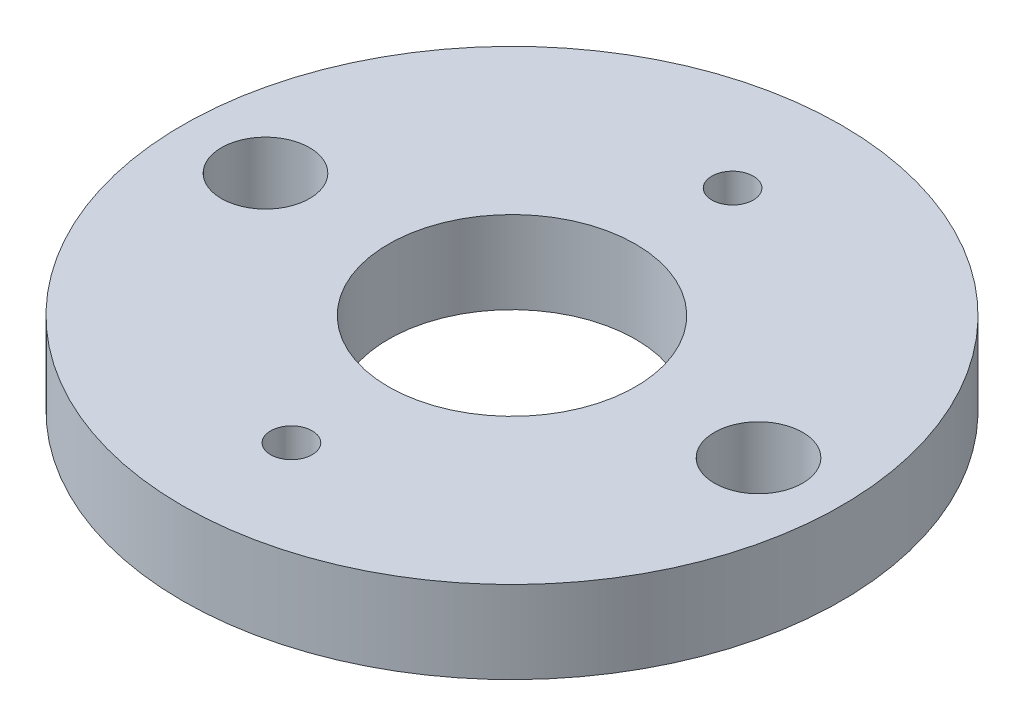
from build123d import *

# Parameters (mm, degrees)
SKETCH1_R                       = 12.7
SKETCH1_R_2                     = 4.7625
BOSS_EXTRUDE1_DEPTH             = 3.175
M3_CLEARANCE_HOLE1_D            = 3.4
M3_CLEARANCE_HOLE1_DEPTH        = 6.35
M3_CLEARANCE_HOLE1_TIP          = 1.021463052
TAP_DRILL_FOR_M2X0_4_TAP1_D     = 1.6
TAP_DRILL_FOR_M2X0_4_TAP1_DEPTH = 6.35
TAP_DRILL_FOR_M2X0_4_TAP1_TIP   = 0.480688495


with BuildPart() as part:
    # Sketch1 → Boss-Extrude1 (new body)
    with BuildSketch(Plane(origin=(0, 0, 0), x_dir=(1, 0, 0), z_dir=(0, 1, 0))):
        with Locations(Location((0, 0, 0), (0, 0, 270))):
            Circle(SKETCH1_R)
        with Locations(Location((0, 0, 0), (0, 0, 270))):
            Circle(SKETCH1_R_2, mode=Mode.SUBTRACT)
    extrude(amount=BOSS_EXTRUDE1_DEPTH)

    # M3 Clearance Hole1
    with Locations(Plane(origin=(0, 3.175, 0), x_dir=(1, 0, 0), z_dir=(0, 1, 0))):
        with Locations((-9.5, 0), (9.5, 0)):
            Hole(M3_CLEARANCE_HOLE1_D / 2, depth=M3_CLEARANCE_HOLE1_DEPTH)
            with Locations((0, 0, -(M3_CLEARANCE_HOLE1_DEPTH + M3_CLEARANCE_HOLE1_TIP / 2))):  # 118° drill point
                Cone(0, M3_CLEARANCE_HOLE1_D / 2, M3_CLEARANCE_HOLE1_TIP, mode=Mode.SUBTRACT)

    # Tap Drill for M2x0.4 Tap1
    with Locations(Plane(origin=(0, 3.175, 0), x_dir=(1, 0, 0), z_dir=(0, 1, 0))):
        with Locations((0, 8.5), (0, -8.5)):
            Hole(TAP_DRILL_FOR_M2X0_4_TAP1_D / 2, depth=TAP_DRILL_FOR_M2X0_4_TAP1_DEPTH)
            with Locations((0, 0, -(TAP_DRILL_FOR_M2X0_4_TAP1_DEPTH + TAP_DRILL_FOR_M2X0_4_TAP1_TIP / 2))):  # 118° drill point
                Cone(0, TAP_DRILL_FOR_M2X0_4_TAP1_D / 2, TAP_DRILL_FOR_M2X0_4_TAP1_TIP, mode=Mode.SUBTRACT)


solid = part.part
